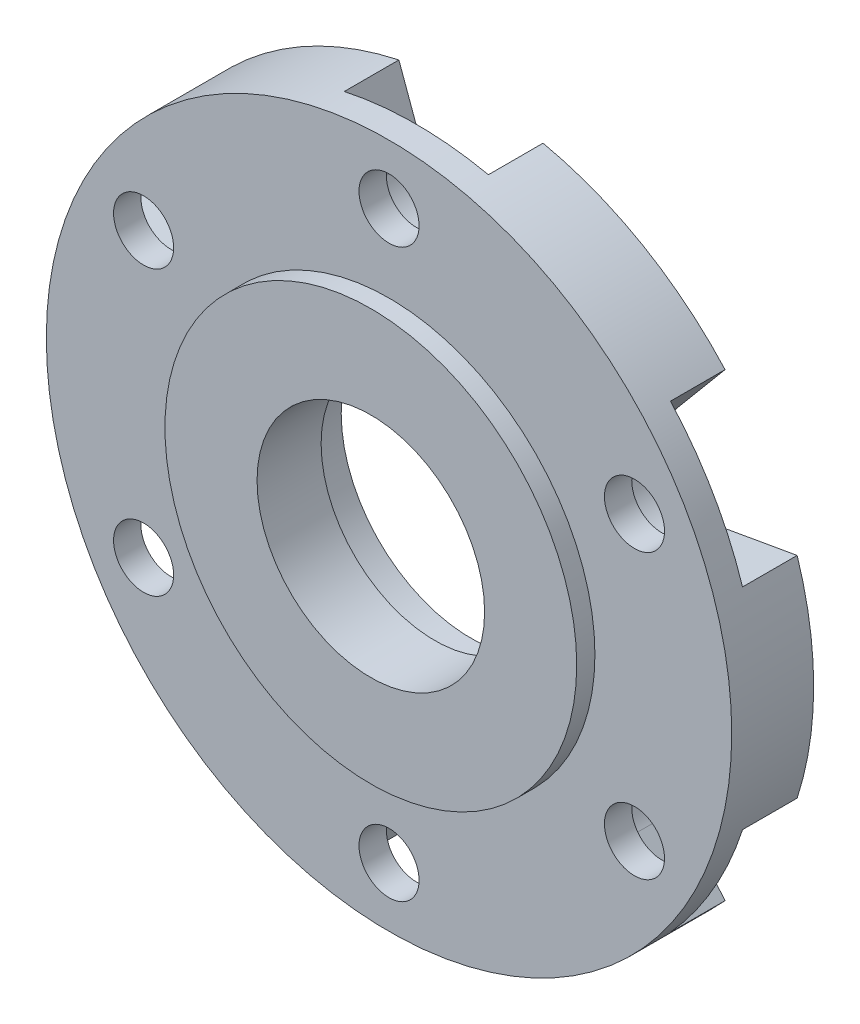
from build123d import *

# Parameters (mm, degrees)
SKETCH_SPINDLE_SKELETON_W      = 1.000000064
SKETCH_SPINDLE_SKELETON_H      = 10.1187
CUT_CENTER_DEPTH               = 54.999231402
CUT_CENTER_DEPTH_BACK          = 54.999231402
SKETCH_CENTER_CUT_R            = 12.5
CBORE_FOR_M6_SHCS1_D           = 6.6
CBORE_FOR_M6_SHCS1_CBORE_D     = 11
CBORE_FOR_M6_SHCS1_CBORE_DEPTH = 6
CIRPATTERN1_COUNT              = 6
SKETCH1_R                      = 14.25575
CUT_EXTRUDE1_DEPTH             = 3.9624
CUT_EXTRUDE2_DEPTH             = 6
CIRPATTERN2_COUNT              = 6


with BuildPart() as part:
    # Sketch Spindle Skeleton → Main Revolve (revolve)
    with BuildSketch(Plane(origin=(0, 0, 0), x_dir=(0, 0, -1), z_dir=(1, 0, 0)), mode=Mode.PRIVATE) as main_revolve_sk:
        Polygon((-25.304999936, 12.5), (-25.304999936, 9.525), (-16.304999902, 9.525), (-16.304999902, 37.64915), (-25.304999936, 37.64915), (-25.304999936, 22.6187), (-26.304999936, 22.6187), (-26.304999936, 12.5), align=None)
        with Locations((-26.804999968, 17.55935)):
            Rectangle(SKETCH_SPINDLE_SKELETON_W, SKETCH_SPINDLE_SKELETON_H)
    revolve(main_revolve_sk.sketch.rotate(Axis((0, 0, 1000), (0, 0, -1)), 90), axis=Axis((0, 0, 1000), (0, 0, -1)))

    # Sketch Center Cut → Cut Center (cut, two sides: drawn at the far end of the back side and taken through both)
    with BuildSketch(Plane.XY.offset(25.304999936).offset(-CUT_CENTER_DEPTH_BACK)):
        Circle(SKETCH_CENTER_CUT_R)
    extrude(amount=CUT_CENTER_DEPTH + CUT_CENTER_DEPTH_BACK, mode=Mode.SUBTRACT)

    # CBORE for M6 SHCS1 (through all)
    with Locations(Plane(origin=(0, 0, 16.304999902), x_dir=(-1, 0, 0), z_dir=(0, 0, -1))):
        with Locations((0, 31.133925032)):
            cbore_for_m6_shcs1 = CounterBoreHole(CBORE_FOR_M6_SHCS1_D / 2, CBORE_FOR_M6_SHCS1_CBORE_D / 2, CBORE_FOR_M6_SHCS1_CBORE_DEPTH)

    # CirPattern1: CBORE for M6 SHCS1 ×6 about axis
    cirpattern1_axis = Axis((0, 0, 0), (0, 0, 1))
    for i in range(1, CIRPATTERN1_COUNT):
        add(cbore_for_m6_shcs1.rotate(cirpattern1_axis, i * 360 / CIRPATTERN1_COUNT), mode=Mode.SUBTRACT)

    # Sketch1 → Cut-Extrude1 (cut)
    with BuildSketch(Plane(origin=(0, 0, 16.304999902), x_dir=(-1, 0, 0), z_dir=(0, 0, -1))):
        Circle(SKETCH1_R)
    extrude(amount=-CUT_EXTRUDE1_DEPTH, mode=Mode.SUBTRACT)

    # Sketch2 → Cut-Extrude2 (cut)
    with BuildSketch(Plane(origin=(0, 0, 16.304999902), x_dir=(-1, 0, 0), z_dir=(0, 0, -1))):
        with BuildLine():
            ThreePointArc((5.5, 31.133925032), (5.416442642, 30.178860055), (5.168309414, 29.252814244))
            Line((5.168309414, 29.252814244), (7.917861182, 36.807145638))
            ThreePointArc((7.917861182, 36.807145638), (3.98125285, 37.438057127), (0, 37.64915))
            Line((0, 37.64915), (0, 36.633925032))
            ThreePointArc((0, 36.633925032), (3.889087297, 35.023012329), (5.5, 31.133925032))
        make_face()
        with BuildLine():
            Line((-7.917861182, 36.807145638), (-5.168309414, 29.252814244))
            ThreePointArc((-5.168309414, 29.252814244), (-4.505336244, 34.288595432), (0, 36.633925032))
            Line((0, 36.633925032), (0, 37.64915))
            ThreePointArc((0, 37.64915), (-3.98125285, 37.438057127), (-7.917861182, 36.807145638))
        make_face()
    cut_extrude2 = extrude(amount=-CUT_EXTRUDE2_DEPTH, mode=Mode.SUBTRACT)

    # CirPattern2: Cut-Extrude2 ×6 about axis
    cirpattern2_axis = Axis((0, 0, 0), (0, 0, 1))
    for i in range(1, CIRPATTERN2_COUNT):
        add(cut_extrude2.rotate(cirpattern2_axis, i * 360 / CIRPATTERN2_COUNT), mode=Mode.SUBTRACT)


solid = part.part
